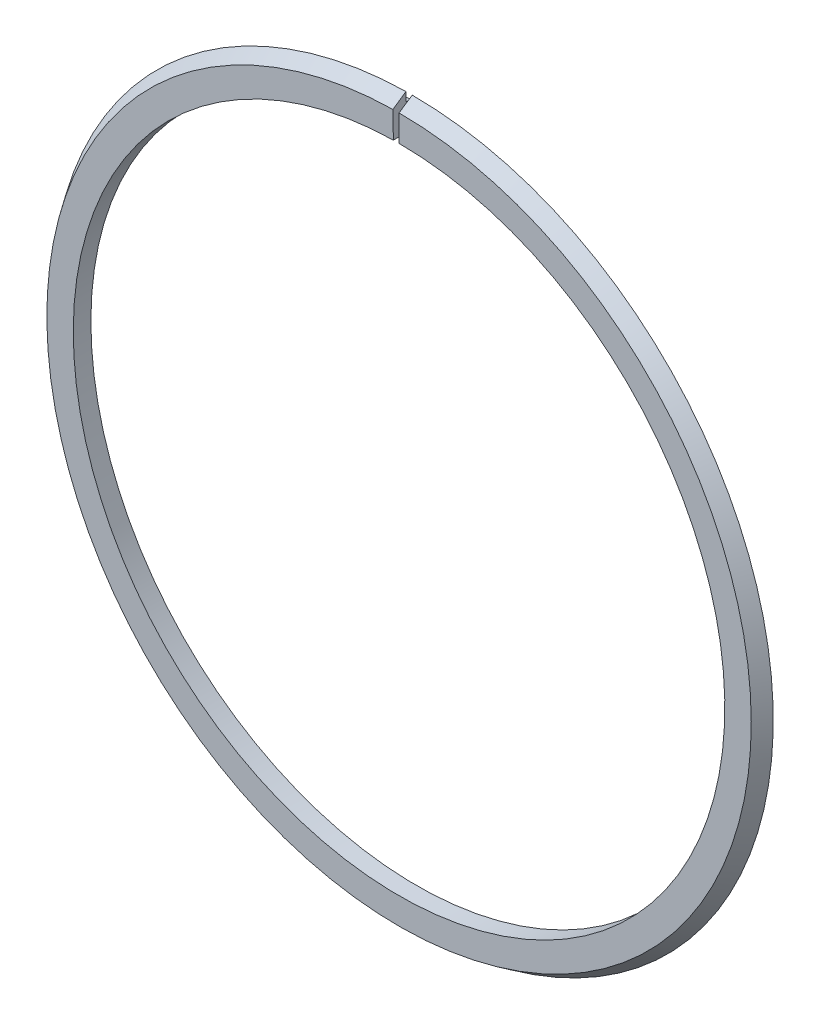
from build123d import *

# Parameters (mm, degrees)
REVOLVE_2_ANGLE = 359


with BuildPart() as part:
    # 草图2 → 旋转2 (revolve)
    with BuildSketch(Plane(origin=(0, 0, 0), x_dir=(0, 1, 0), z_dir=(-1, 0, 0))):
        Polygon((37, 0), (40, 0), (41, 1.5), (40, 1.5), (40, 2), (37, 2), align=None)
    revolve(axis=Axis((0, 0, 0), (0, 0, -1)), revolution_arc=REVOLVE_2_ANGLE)


solid = part.part
